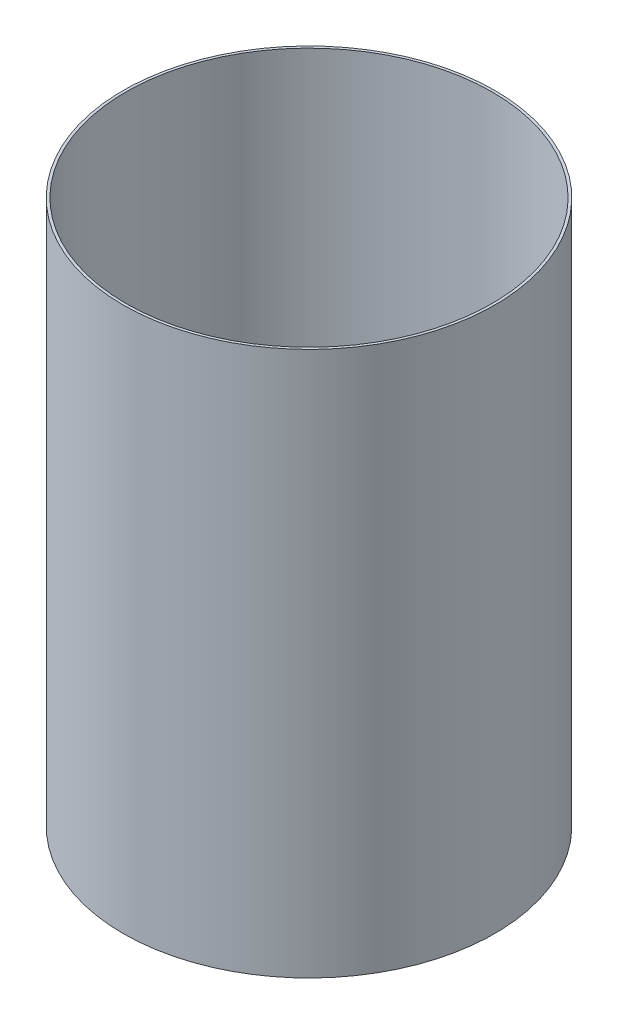
from build123d import *

# Parameters (mm, degrees)
SKETCH1_R           = 71
SKETCH1_R_2         = 70
BOSS_EXTRUDE1_DEPTH = 206
BOSS_EXTRUDE2_START = 2
SKETCH2_R           = 71
BOSS_EXTRUDE2_DEPTH = 2


with BuildPart() as part:
    # Sketch1 → Boss-Extrude1 (new body)
    with BuildSketch(Plane(origin=(0, 0, 0), x_dir=(1, 0, 0), z_dir=(0, 1, 0))):
        with Locations(Location((0, 0, 0), (0, 0, 270))):
            Circle(SKETCH1_R)
        with Locations(Location((0, 0, 0), (0, 0, 270))):
            Circle(SKETCH1_R_2, mode=Mode.SUBTRACT)
    extrude(amount=BOSS_EXTRUDE1_DEPTH)

    # Sketch2 → Boss-Extrude2 (add)
    with BuildSketch(Plane.XZ.offset(BOSS_EXTRUDE2_START)):
        with Locations(Location((0, 0, 0), (0, 0, 270))):
            Circle(SKETCH2_R)
    extrude(amount=-BOSS_EXTRUDE2_DEPTH)


solid = part.part
